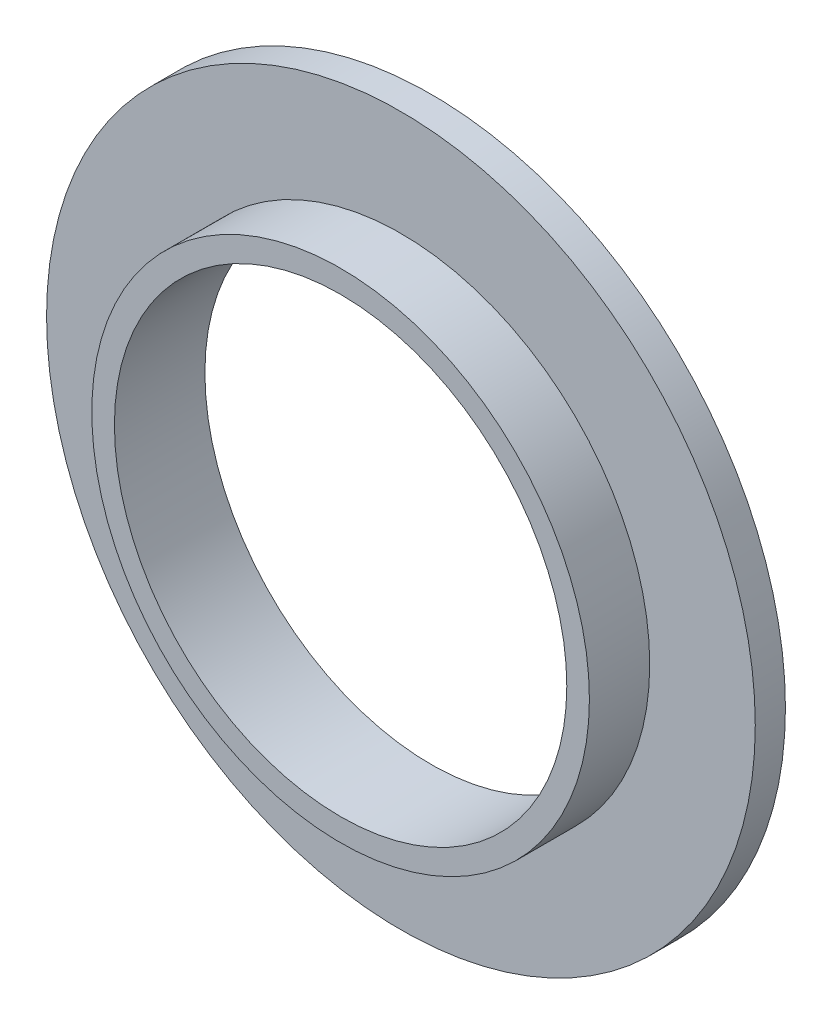
from build123d import *
from build123d.topology import SkipClean

# Parameters (mm, degrees)
SKETCH1_R           = 23.5
BOSS_EXTRUDE1_DEPTH = 2
SKETCH2_R           = 16.5
SKETCH2_R_2         = 15
BOSS_EXTRUDE2_DEPTH = 4
SKETCH3_R           = 15
CUT_EXTRUDE1_DEPTH  = 4


with BuildPart() as part:
    # Sketch1 → Boss-Extrude1 (new body)
    with BuildSketch(Plane.XY):
        Circle(SKETCH1_R)
    extrude(amount=BOSS_EXTRUDE1_DEPTH)

    # Sketch2 → Boss-Extrude2 (add)
    with BuildSketch(Plane.XY.offset(2)):
        Circle(SKETCH2_R)
        Circle(SKETCH2_R_2, mode=Mode.SUBTRACT)
    extrude(amount=BOSS_EXTRUDE2_DEPTH)

    # Sketch3 → Cut-Extrude1 (cut)
    with SkipClean():  # the faces are left unmerged after this step: merging them gives an invalid solid
        with BuildSketch(Plane(origin=(0, 0, 0), x_dir=(-1, 0, 0), z_dir=(0, 0, -1))):
            Circle(SKETCH3_R)
        extrude(amount=-CUT_EXTRUDE1_DEPTH, mode=Mode.SUBTRACT)


solid = part.part
